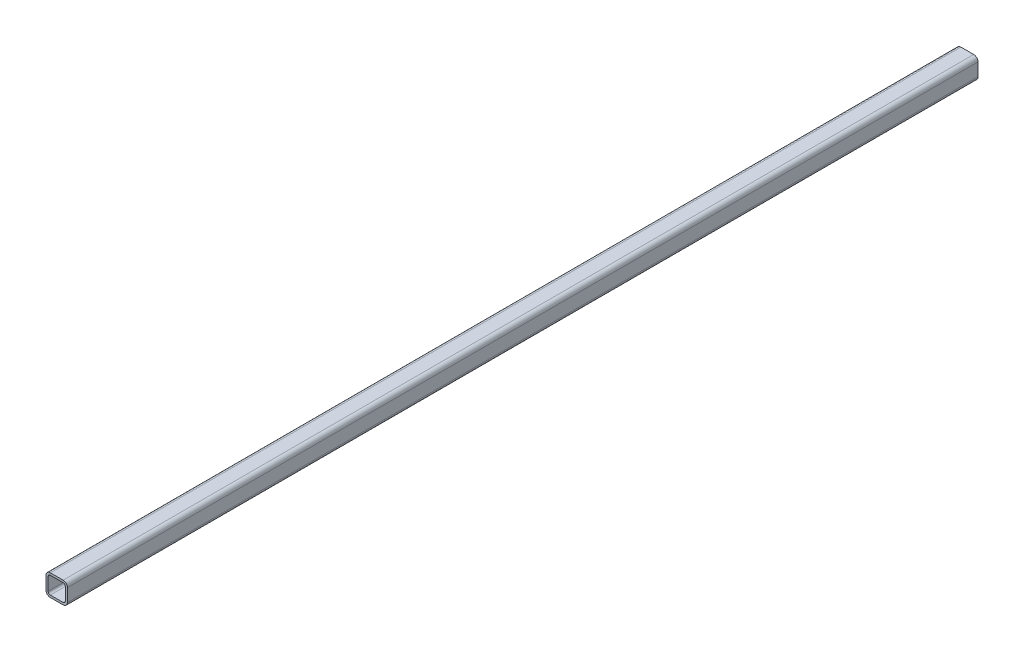
from build123d import *

# Parameters (mm, degrees)
SQUARE_TUBE_40_X_40_X_4_2_DEPTH = 1700.022


with BuildPart() as part:
    # Sketch13 → Square tube 40 X 40 X 4(2) (new body)
    with BuildSketch(Plane.XY.offset(-850.011)):
        with BuildLine():
            Line((-12, -20), (12, -20))
            ThreePointArc((12, -20), (17.656854249, -17.656854249), (20, -12))
            Line((20, -12), (20, 12))
            ThreePointArc((20, 12), (17.656854249, 17.656854249), (12, 20))
            Line((12, 20), (-12, 20))
            ThreePointArc((-12, 20), (-17.656854249, 17.656854249), (-20, 12))
            Line((-20, 12), (-20, -12))
            ThreePointArc((-20, -12), (-17.656854249, -17.656854249), (-12, -20))
        make_face()
        with BuildLine():
            Line((-12, -16), (12, -16))
            ThreePointArc((12, -16), (14.828427125, -14.828427125), (16, -12))
            Line((16, -12), (16, 12))
            ThreePointArc((16, 12), (14.828427125, 14.828427125), (12, 16))
            Line((12, 16), (-12, 16))
            ThreePointArc((-12, 16), (-14.828427125, 14.828427125), (-16, 12))
            Line((-16, 12), (-16, -12))
            ThreePointArc((-16, -12), (-14.828427125, -14.828427125), (-12, -16))
        make_face(mode=Mode.SUBTRACT)
    extrude(amount=SQUARE_TUBE_40_X_40_X_4_2_DEPTH)


solid = part.part
